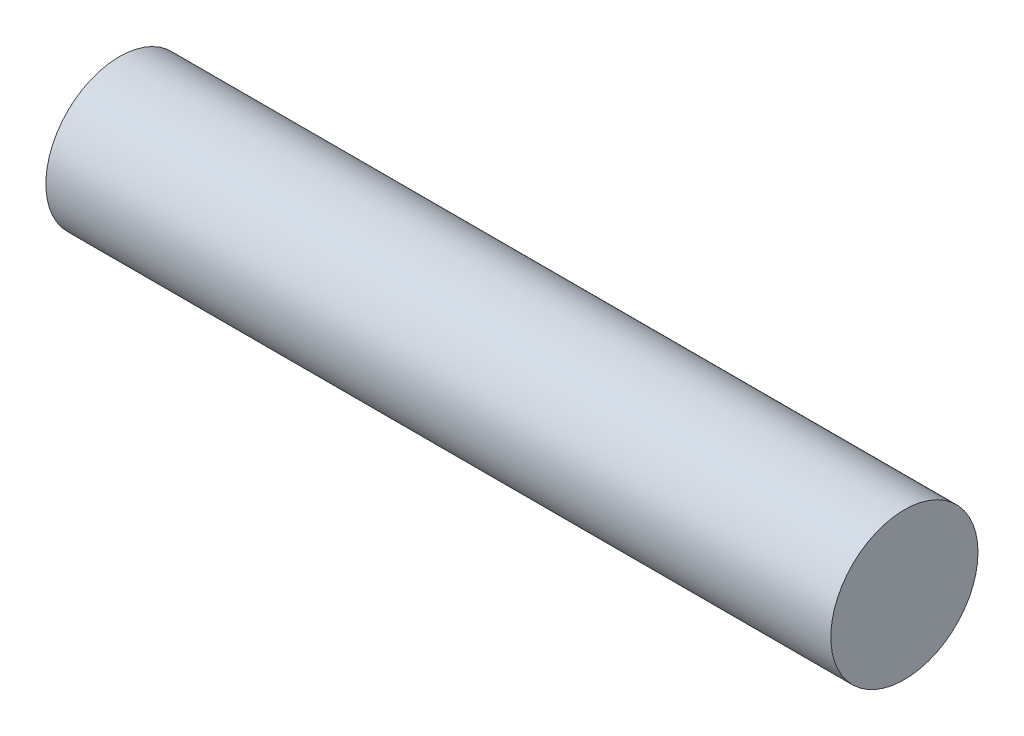
from build123d import *

# Parameters (mm, degrees)
SKETCH1_R           = 2.38125
BOSS_EXTRUDE1_DEPTH = 25.4


with BuildPart() as part:
    # Sketch1 → Boss-Extrude1 (new body)
    with BuildSketch(Plane(origin=(0, 0, 0), x_dir=(0, 0, -1), z_dir=(1, 0, 0))):
        Circle(SKETCH1_R)
    extrude(amount=BOSS_EXTRUDE1_DEPTH)


solid = part.part
